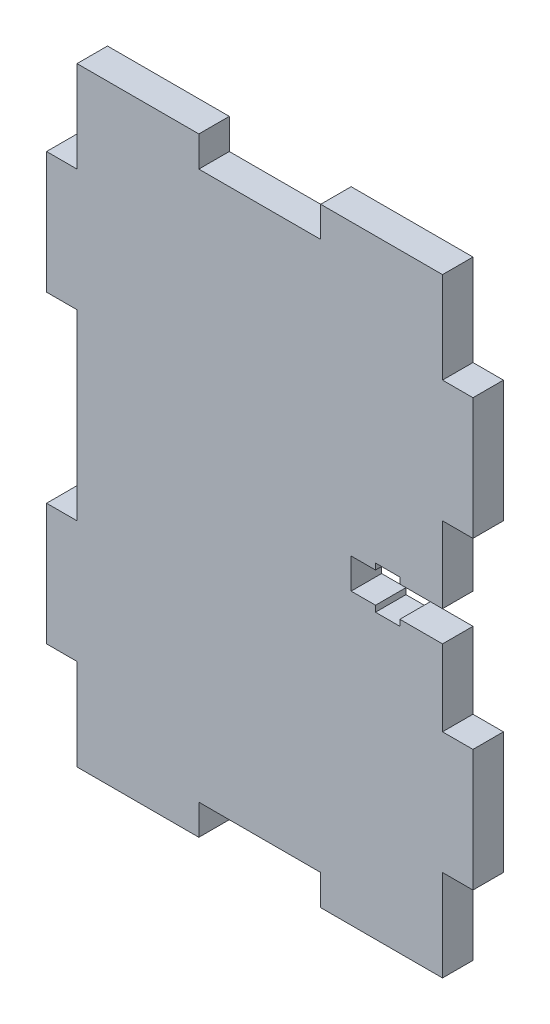
from build123d import *

# Parameters (mm, degrees)
BOSS_EXTRU_1_DEPTH = 5


with BuildPart() as part:
    # Esquisse1 → Boss.-Extru.1 (new body)
    with BuildSketch(Plane.XY):
        Polygon((12.882352941, 41.5), (32.882352941, 41.5), (32.882352941, 46.5), (52.882352941, 46.5), (52.882352941, 31.5), (57.882352941, 31.5), (57.882352941, 11.5), (52.882352941, 11.5), (52.882352941, -1), (45.882352941, -1), (45.882352941, 0), (41.882352941, 0), (41.882352941, -1), (37.882352941, -1), (37.882352941, -6), (41.882352941, -6), (41.882352941, -7), (45.882352941, -7), (45.882352941, -6), (52.882352941, -6), (52.882352941, -18.5), (57.882352941, -18.5), (57.882352941, -38.5), (52.882352941, -38.5), (52.882352941, -53.5), (32.882352941, -53.5), (32.882352941, -48.5), (12.882352941, -48.5), (12.882352941, -53.5), (-7.117647059, -53.5), (-7.117647059, -38.5), (-12.117647059, -38.5), (-12.117647059, -18.5), (-7.117647059, -18.5), (-7.117647059, 11.5), (-12.117647059, 11.5), (-12.117647059, 31.5), (-7.117647059, 31.5), (-7.117647059, 46.5), (12.882352941, 46.5), align=None)
    extrude(amount=BOSS_EXTRU_1_DEPTH)


solid = part.part
